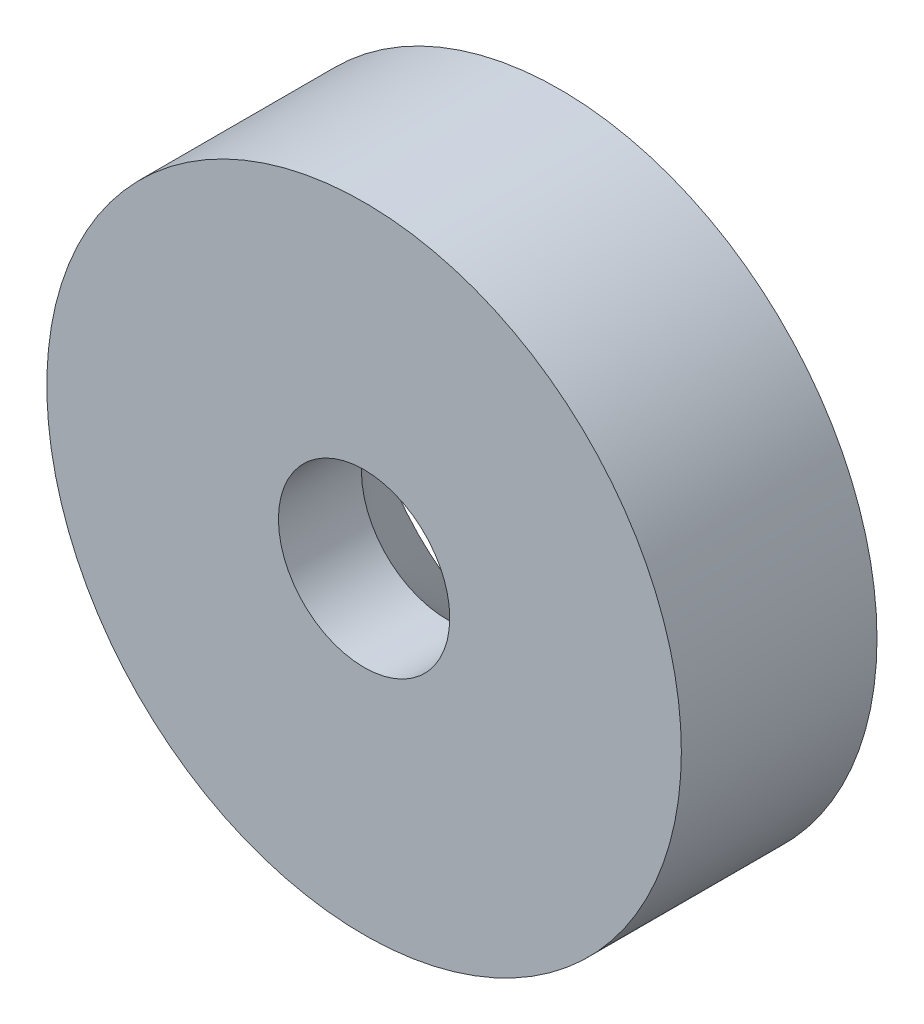
from build123d import *

# Parameters (mm, degrees)
SKETCH1_R           = 6
SKETCH1_R_2         = 1.62
BOSS_EXTRUDE1_DEPTH = 3.7


with BuildPart() as part:
    # Sketch1 → Boss-Extrude1 (new body)
    with BuildSketch(Plane.XY):
        with Locations((5.056285212, 23.07899143)):
            Circle(SKETCH1_R)
        with Locations((5.056285212, 23.07899143)):
            Circle(SKETCH1_R_2, mode=Mode.SUBTRACT)
    extrude(amount=BOSS_EXTRUDE1_DEPTH)

    # Cut-Extrude1 cone 1 section (through the dimple's axis) → Cut-Extrude1 (revolve, cut)
    with BuildSketch(Plane(origin=(5.056285212, 23.07899143, 0), x_dir=(0, 1, 0), z_dir=(1, 0, 0))):
        Polygon((0, 0), (3.75, 0), (0, 3.75), align=None)
    revolve(axis=Axis((5.056285212, 23.07899143, 0), (0, 0, 1)), mode=Mode.SUBTRACT)


solid = part.part
